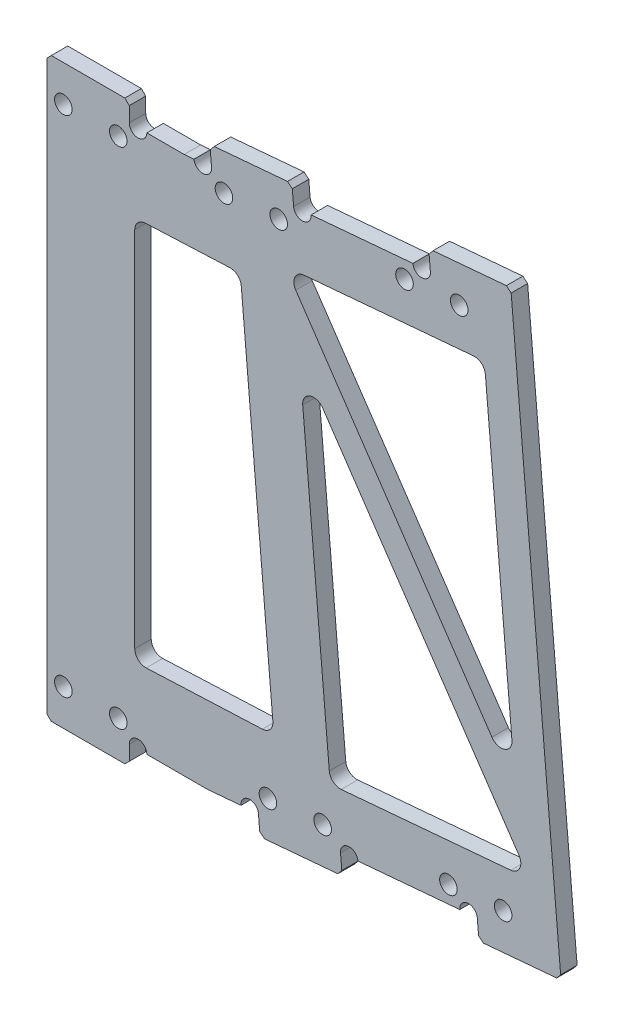
from build123d import *

# Parameters (mm, degrees)
EXTRUDE_1_DEPTH     = 3
EXTRUDE_2_DEPTH     = 3
SKETCH_3_R          = 1.6
CUT_EXTRUDE_1_DEPTH = 168.152318263
SKETCH_4_W          = 15
SKETCH_4_H          = 3.5
EXTRUDE_3_DEPTH     = 3
SKETCH_5_R          = 1.6
CUT_EXTRUDE_2_DEPTH = 168.152318263
CHAMFER_1_SIZE      = 0.8
CUT_EXTRUDE_3_DEPTH = 168.054153154
CUT_EXTRUDE_4_DEPTH = 10


with BuildPart() as part:
    # 草图1 → 凸台-拉伸1 (new body)
    with BuildSketch(Plane.XY):
        Polygon((0, 0), (0, 98), (60, 98), (119.771681886, 103.229344565), (128.312944675, 5.602264152), (64.278772405, 0), align=None)
    extrude(amount=EXTRUDE_1_DEPTH)

    # 草图2 → 凸台-拉伸2 (add, through all)
    with BuildSketch(Plane.XY):
        Polygon((119.771681886, 103.229344565), (104.828761414, 101.922008424), (104.523716315, 105.408689867), (119.466636786, 106.716026008), align=None)
        Polygon((79.923893962, 99.743114855), (64.98097349, 98.435778714), (64.675928391, 101.922460157), (79.618848862, 103.229796298), align=None)
        Polygon((128.617989774, 2.115582709), (113.675069303, 0.808246567), (113.370024203, 4.294928011), (128.312944675, 5.602264152), align=None)
        Polygon((88.770201851, -1.370647001), (73.827281379, -2.677983143), (73.52223628, 0.808698301), (88.465156751, 2.116034442), align=None)
    extrude(amount=EXTRUDE_2_DEPTH)

    # 草图3 → 切除-拉伸1 (cut, through all)
    with BuildSketch(Plane.XY):
        with Locations((110.079917707, 99.269583573)):
            Circle(SKETCH_3_R)
        with Locations((100.117970726, 98.398026146)):
            Circle(SKETCH_3_R)
        with Locations((77.20549267, 96.393444063)):
            Circle(SKETCH_3_R)
        with Locations((67.243545689, 95.521886635)):
            Circle(SKETCH_3_R)
        with Locations(Location((118.080814891, 7.818910288, 0), (0, 0, 180))):
            Circle(SKETCH_3_R)
        with Locations(Location((108.11886791, 6.947352861, 0), (0, 0, 180))):
            Circle(SKETCH_3_R)
        with Locations(Location((85.206389854, 4.942770778, 0), (0, 0, 180))):
            Circle(SKETCH_3_R)
        with Locations(Location((75.244442873, 4.07121335, 0), (0, 0, 180))):
            Circle(SKETCH_3_R)
        with BuildLine():
            Line((101.64093838, 101.643110047), (104.828761414, 101.922008424))
            ThreePointArc((104.828761414, 101.922008424), (103.374299086, 100.188647718), (101.64093838, 101.643110047))
        make_face()
        with BuildLine():
            Line((79.923893962, 99.743114855), (83.111716996, 100.022013232))
            ThreePointArc((83.111716996, 100.022013232), (81.657254667, 98.288652526), (79.923893962, 99.743114855))
        make_face()
        with BuildLine():
            Line((61.793150457, 98.156880337), (64.98097349, 98.435778714))
            ThreePointArc((64.98097349, 98.435778714), (63.526511162, 96.702418008), (61.793150457, 98.156880337))
        make_face()
        with BuildLine():
            Line((70.334413246, 0.529799924), (73.52223628, 0.808698301))
            ThreePointArc((73.52223628, 0.808698301), (71.788875574, 2.263160629), (70.334413246, 0.529799924))
        make_face()
        with BuildLine():
            Line((88.465156751, 2.116034442), (91.652979785, 2.394932819))
            ThreePointArc((91.652979785, 2.394932819), (89.91961908, 3.849395147), (88.465156751, 2.116034442))
        make_face()
        with BuildLine():
            Line((110.18220117, 4.016029634), (113.370024203, 4.294928011))
            ThreePointArc((113.370024203, 4.294928011), (111.636663498, 5.749390339), (110.18220117, 4.016029634))
        make_face()
    extrude(amount=CUT_EXTRUDE_1_DEPTH, mode=Mode.SUBTRACT)

    # 草图4 → 凸台-拉伸3 (add, through all)
    with BuildSketch(Plane.XY):
        with Locations((42.5, 99.75)):
            Rectangle(SKETCH_4_W, SKETCH_4_H)
        with Locations((7.5, 99.75)):
            Rectangle(SKETCH_4_W, SKETCH_4_H)
        with Locations((42.5, -1.75)):
            Rectangle(SKETCH_4_W, SKETCH_4_H)
        with Locations((7.5, -1.75)):
            Rectangle(SKETCH_4_W, SKETCH_4_H)
    extrude(amount=EXTRUDE_3_DEPTH)

    # 草图5 → 切除-拉伸2 (cut, through all)
    with BuildSketch(Plane.XY):
        with Locations((3, 94.9)):
            Circle(SKETCH_5_R)
        with Locations((13, 94.9)):
            Circle(SKETCH_5_R)
        with Locations((38, 94.9)):
            Circle(SKETCH_5_R)
        with Locations((48, 94.9)):
            Circle(SKETCH_5_R)
        with Locations(Location((3, 3.1, 0), (0, 0, 180))):
            Circle(SKETCH_5_R)
        with Locations(Location((13, 3.1, 0), (0, 0, 180))):
            Circle(SKETCH_5_R)
        with Locations(Location((48, 3.1, 0), (0, 0, 180))):
            Circle(SKETCH_5_R)
        with Locations(Location((38, 3.1, 0), (0, 0, 180))):
            Circle(SKETCH_5_R)
        with BuildLine():
            Line((15, 98), (18.2, 98))
            ThreePointArc((18.2, 98), (16.6, 96.4), (15, 98))
        make_face()
        with BuildLine():
            Line((31.8, 98), (35, 98))
            ThreePointArc((35, 98), (33.4, 96.4), (31.8, 98))
        make_face()
        with BuildLine():
            Line((50, 98), (53.2, 98))
            ThreePointArc((53.2, 98), (51.6, 96.4), (50, 98))
        make_face()
        with BuildLine():
            Line((50, 0), (53.2, 0))
            ThreePointArc((53.2, 0), (51.6, 1.6), (50, 0))
        make_face()
        with BuildLine():
            Line((31.8, 0), (35, 0))
            ThreePointArc((35, 0), (33.4, 1.6), (31.8, 0))
        make_face()
        with BuildLine():
            Line((15, 0), (18.2, 0))
            ThreePointArc((18.2, 0), (16.6, 1.6), (15, 0))
        make_face()
    extrude(amount=CUT_EXTRUDE_2_DEPTH, mode=Mode.SUBTRACT)

    # 倒角1
    chamfer_1_edges = [part.edges().sort_by_distance(p)[0] for p in [
        (0, 101.5, 1.5),
        (15, 101.5, 1.5),
        (35, -3.5, 1.5),
        (50, -3.5, 1.5),
        (35, 101.5, 1.5),
        (50, 101.5, 1.5),
        (0, -3.5, 1.5),
        (15, -3.5, 1.5),
        (119.466636786, 106.716026008, 1.5),
        (104.523716315, 105.408689867, 1.5),
        (79.618848862, 103.229796298, 1.5),
        (64.675928391, 101.922460157, 1.5),
        (128.617989774, 2.115582709, 1.5),
        (113.675069303, 0.808246567, 1.5),
        (88.770201851, -1.370647001, 1.5),
        (73.827281379, -2.677983143, 1.5),
    ]]
    chamfer(chamfer_1_edges, length=CHAMFER_1_SIZE)

    # 草图6 → 切除-拉伸3 (cut, through all)
    with BuildSketch(Plane.XY):
        with BuildLine():
            Line((88.589794022, 12.165137166), (119.471829663, 14.866965191))
            ThreePointArc((119.471829663, 14.866965191), (121.103967944, 16.001019432), (120.952257678, 17.982669852))
            Line((120.952257678, 17.982669852), (85.230022186, 70.604579281))
            ThreePointArc((85.230022186, 70.604579281), (82.904864414, 71.365551505), (81.582893289, 69.306952531))
            Line((81.582893289, 69.306952531), (86.42309314, 13.983215076))
            ThreePointArc((86.42309314, 13.983215076), (87.129907317, 12.625437676), (88.589794022, 12.165137166))
        make_face()
        with BuildLine():
            Line((119.680582461, 35.428336277), (114.84038261, 90.752073731))
            ThreePointArc((114.84038261, 90.752073731), (114.133568433, 92.109851132), (112.673681728, 92.570151642))
            Line((112.673681728, 92.570151642), (81.791646087, 89.868323617))
            ThreePointArc((81.791646087, 89.868323617), (80.159507806, 88.734269376), (80.311218072, 86.752618956))
            Line((80.311218072, 86.752618956), (116.033453564, 34.130709527))
            ThreePointArc((116.033453564, 34.130709527), (118.358611336, 33.369737303), (119.680582461, 35.428336277))
        make_face()
        with BuildLine():
            Line((51, 81.632404391), (51, 15.56952717))
            ThreePointArc((51, 15.56952717), (51.616973888, 14.124799246), (53.087238775, 13.571430727))
            Line((53.087238775, 13.571430727), (74.244890746, 14.495193762))
            ThreePointArc((74.244890746, 14.495193762), (75.661331586, 15.174598575), (76.150041367, 16.667601691))
            Line((76.150041367, 16.667601691), (70.392282235, 82.479089719))
            ThreePointArc((70.392282235, 82.479089719), (69.718584469, 83.808457848), (68.312654064, 84.302874676))
            Line((68.312654064, 84.302874676), (52.912761225, 83.630500834))
            ThreePointArc((52.912761225, 83.630500834), (51.555272076, 83.015430503), (51, 81.632404391))
        make_face()
    extrude(amount=CUT_EXTRUDE_3_DEPTH, mode=Mode.SUBTRACT)

    # 草图7 → 切除-拉伸4 (cut)
    with BuildSketch(Plane.XY.offset(3)):
        Polygon((35, 98), (35, 0), (27.806316321, -5.327994522), (11.72452964, -8.165956877), (-13.438736579, -4.098210834), (-15.046915247, 45.849926623), (-17.790278858, 82.365042265), (-16.749692661, 87.378775759), (-5.587040729, 104.690346128), (16.549065644, 104.690346128), align=None)
    extrude(amount=-CUT_EXTRUDE_4_DEPTH, mode=Mode.SUBTRACT)


solid = part.part
